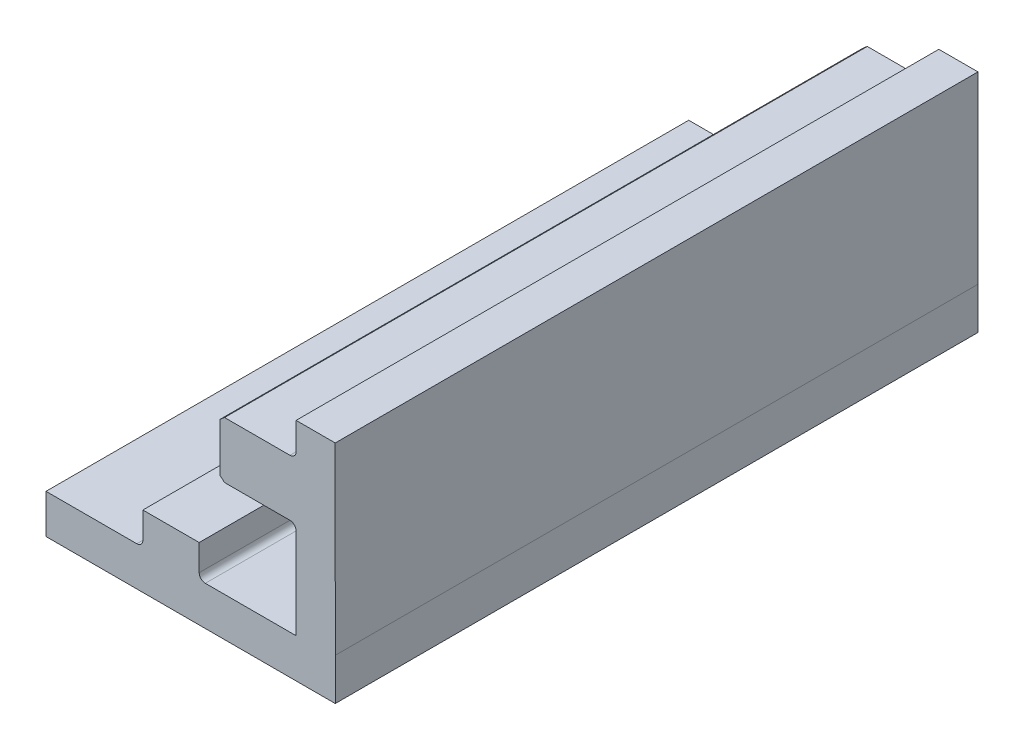
from build123d import *

# Parameters (mm, degrees)
BOSS_EXTRUDE1_DEPTH = 66.675
CUT_EXTRUDE1_REACH  = 75.8
CUT_EXTRUDE2_REACH  = 75.8
SKETCH6_W           = 5.842
SKETCH6_H           = 4.878381591
CUT_EXTRUDE4_DEPTH  = 74.800184057


with BuildPart() as part:
    # Sketch1 → Boss-Extrude1 (new body)
    with BuildSketch(Plane(origin=(0, 0, -3683), x_dir=(-1, 0, 0), z_dir=(0, 0, -1))):
        with BuildLine():
            Line((7.945265893, 3.588862728), (-1.198734107, 3.588862728))
            ThreePointArc((-1.198734107, 3.588862728), (-1.647746913, 3.774849922), (-1.833734107, 4.223862728))
            Line((-1.833734107, 4.223862728), (-1.833734107, 5.747862728))
            ThreePointArc((-1.833734107, 5.747862728), (-1.647746913, 6.196875535), (-1.198734107, 6.382862728))
            Line((-1.198734107, 6.382862728), (1.621629442, 6.382862728))
            Line((1.621629442, 6.382862728), (1.621629442, 6.890862686))
            Line((1.621629442, 6.890862686), (-2.214734107, 11.462862728))
            Line((-2.214734107, 11.462862728), (-7.294734107, 11.462862728))
            Line((-7.294734107, 11.462862728), (-11.131097656, 6.890862686))
            Line((-11.131097656, 6.890862686), (-11.131097656, 6.382862728))
            Line((-11.131097656, 6.382862728), (-8.310734107, 6.382862728))
            ThreePointArc((-8.310734107, 6.382862728), (-7.861721301, 6.196875535), (-7.675734107, 5.747862728))
            Line((-7.675734107, 5.747862728), (-7.675734107, 4.223862728))
            ThreePointArc((-7.675734107, 4.223862728), (-7.861721301, 3.774849922), (-8.310734107, 3.588862728))
            Line((-8.310734107, 3.588862728), (-17.454734107, 3.588862728))
            Line((-17.454734107, 3.588862728), (-17.727921752, 3.588862728))
            Line((-17.727921752, 3.588862728), (-17.727921752, 3.858842754))
            Line((-17.727921752, 3.858842754), (-17.728361466, 13.002372481))
            ThreePointArc((-17.728361466, 13.002372481), (-17.542256287, 13.451715967), (-17.092921752, 13.637842754))
            Line((-17.092921752, 13.637842754), (-15.568921752, 13.637842754))
            ThreePointArc((-15.568921752, 13.637842754), (-15.119908946, 13.45185556), (-14.933921752, 13.002842754))
            Line((-14.933921752, 13.002842754), (-14.933921752, 10.182479205))
            Line((-14.933921752, 10.182479205), (-14.425921794, 10.182479205))
            Line((-14.425921794, 10.182479205), (-9.853921752, 14.018842754))
            Line((-9.853921752, 14.018842754), (-9.853921752, 19.098842754))
            Line((-9.853921752, 19.098842754), (-14.425921794, 22.935206303))
            Line((-14.425921794, 22.935206303), (-14.933921752, 22.935206303))
            Line((-14.933921752, 22.935206303), (-14.933921752, 20.114842754))
            ThreePointArc((-14.933921752, 20.114842754), (-15.119908946, 19.665829948), (-15.568921752, 19.479842754))
            Line((-15.568921752, 19.479842754), (-17.092921752, 19.479842754))
            ThreePointArc((-17.092921752, 19.479842754), (-17.542476558, 19.66604812), (-17.728703542, 20.11559397))
            Line((-17.728703542, 20.11559397), (-17.728839138, 22.935206303))
            Line((-17.728839138, 22.935206303), (-21.787214199, 22.935206303))
            Line((-21.787214199, 22.935206303), (-21.791921752, 3.859128788))
            Line((-21.791921752, 3.859128788), (-21.791921752, 3.588862728))
            Line((-21.791921752, 3.588862728), (-21.791921752, -0.475137272))
            Line((-21.791921752, -0.475137272), (-17.727921752, -0.475137272))
            Line((-17.727921752, -0.475137272), (-17.454774021, -0.475137272))
            Line((-17.454774021, -0.475137272), (7.945225979, -0.475137272))
            Line((7.945225979, -0.475137272), (8.215492039, -0.475137272))
            Line((8.215492039, -0.475137272), (8.215492039, 3.588862728))
            Line((8.215492039, 3.588862728), (7.945265893, 3.588862728))
        make_face()
    extrude(amount=BOSS_EXTRUDE1_DEPTH)

    # Sketch2 → Cut-Extrude1 (cut, up to next)
    with BuildSketch(Plane.XY.offset(-3683), mode=Mode.PRIVATE) as cut_extrude1_sk1:
        with BuildLine():
            Line((11.131097656, 6.890862686), (11.131097656, 6.382862728))
            Line((11.131097656, 6.382862728), (8.310734107, 6.382862728))
            ThreePointArc((8.310734107, 6.382862728), (7.861721301, 6.196875535), (7.675734107, 5.747862728))
            Line((7.675734107, 5.747862728), (7.675734107, 11.00880461))
            Line((7.675734107, 11.00880461), (11.131097656, 6.890862686))
        make_face()
    cut_extrude1_tool1 = extrude(cut_extrude1_sk1.sketch, amount=-CUT_EXTRUDE1_REACH, mode=Mode.PRIVATE) & part.part
    # Sketch2 → Cut-Extrude1 (cut, up to next)
    with BuildSketch(Plane.XY.offset(-3683), mode=Mode.PRIVATE) as cut_extrude1_sk2:
        with BuildLine():
            Line((1.833734107, 5.747862728), (1.833734107, 11.00880461))
            Line((1.833734107, 11.00880461), (-1.621629442, 6.890862686))
            Line((-1.621629442, 6.890862686), (-1.621629442, 6.382862728))
            Line((-1.621629442, 6.382862728), (1.198734107, 6.382862728))
            ThreePointArc((1.198734107, 6.382862728), (1.647746913, 6.196875535), (1.833734107, 5.747862728))
        make_face()
    cut_extrude1_tool2 = extrude(cut_extrude1_sk2.sketch, amount=-CUT_EXTRUDE1_REACH, mode=Mode.PRIVATE) & part.part
    add(cut_extrude1_tool1.solids().sort_by_distance((8.930632, 7.925168, -3683))[0], mode=Mode.SUBTRACT)
    add(cut_extrude1_tool2.solids().sort_by_distance((0.578837, 7.925168, -3683))[0], mode=Mode.SUBTRACT)

    # Sketch3 → Cut-Extrude2 (cut, up to next)
    with BuildSketch(Plane.XY.offset(-3683), mode=Mode.PRIVATE) as cut_extrude2_sk1:
        with BuildLine():
            Line((15.568921752, 19.479842754), (10.307979871, 19.479842754))
            Line((10.307979871, 19.479842754), (14.425921794, 22.935206303))
            Line((14.425921794, 22.935206303), (14.933921752, 22.935206303))
            Line((14.933921752, 22.935206303), (14.933921752, 20.114842754))
            ThreePointArc((14.933921752, 20.114842754), (15.119908946, 19.665829948), (15.568921752, 19.479842754))
        make_face()
    cut_extrude2_tool1 = extrude(cut_extrude2_sk1.sketch, amount=-CUT_EXTRUDE2_REACH, mode=Mode.PRIVATE) & part.part
    # Sketch3 → Cut-Extrude2 (cut, up to next)
    with BuildSketch(Plane.XY.offset(-3683), mode=Mode.PRIVATE) as cut_extrude2_sk2:
        with BuildLine():
            Line((10.307979871, 13.637842754), (14.425921794, 10.182479205))
            Line((14.425921794, 10.182479205), (14.933921752, 10.182479205))
            Line((14.933921752, 10.182479205), (14.933921752, 13.002842754))
            ThreePointArc((14.933921752, 13.002842754), (15.119908946, 13.45185556), (15.568921752, 13.637842754))
            Line((15.568921752, 13.637842754), (10.307979871, 13.637842754))
        make_face()
    cut_extrude2_tool2 = extrude(cut_extrude2_sk2.sketch, amount=-CUT_EXTRUDE2_REACH, mode=Mode.PRIVATE) & part.part
    add(cut_extrude2_tool1.solids().sort_by_distance((13.391616, 20.73474, -3683))[0], mode=Mode.SUBTRACT)
    add(cut_extrude2_tool2.solids().sort_by_distance((13.391616, 12.382945, -3683))[0], mode=Mode.SUBTRACT)

    # Sketch6 → Cut-Extrude4 (cut, through all)
    with BuildSketch(Plane(origin=(0, 0, -3749.675), x_dir=(-1, 0, 0), z_dir=(0, 0, -1))):
        with Locations((-4.754734107, 9.374581689)):
            Rectangle(SKETCH6_W, SKETCH6_H)
    extrude(amount=-CUT_EXTRUDE4_DEPTH, mode=Mode.SUBTRACT)


solid = part.part
